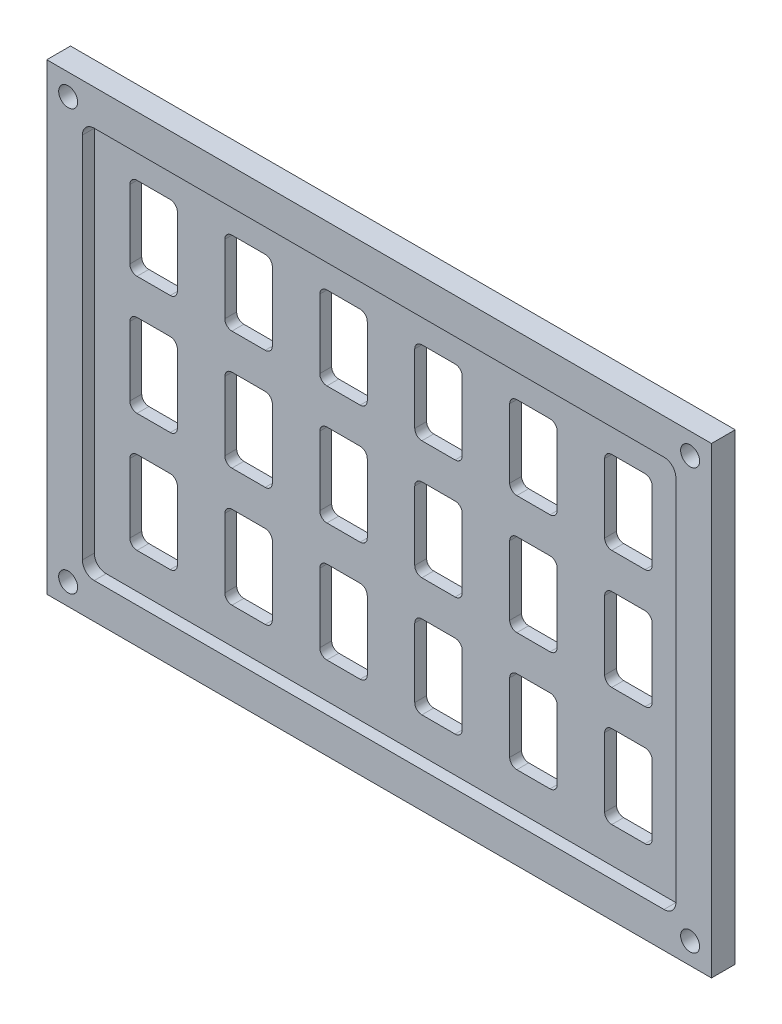
from build123d import *

# Parameters (mm, degrees)
SKETCH1_W           = 280
SKETCH1_H           = 195
BOSS_EXTRUDE1_DEPTH = 5
SKETCH9_W           = 280
SKETCH9_H           = 195
BOSS_EXTRUDE2_DEPTH = 5
SKETCH10_R          = 4
CUT_EXTRUDE1_DEPTH  = 171.898361607


with BuildPart() as part:
    # Sketch1 → Boss-Extrude1 (new body)
    with BuildSketch(Plane.XY):
        Rectangle(SKETCH1_W, SKETCH1_H)
        with BuildLine():
            Line((-70, 64.5), (-70, 35.5))
            ThreePointArc((-70, 35.5), (-69.121320344, 33.378679656), (-67, 32.5))
            Line((-67, 32.5), (-53, 32.5))
            ThreePointArc((-53, 32.5), (-50.878679656, 33.378679656), (-50, 35.5))
            Line((-50, 35.5), (-50, 64.5))
            ThreePointArc((-50, 64.5), (-50.878679656, 66.621320344), (-53, 67.5))
            Line((-53, 67.5), (-67, 67.5))
            ThreePointArc((-67, 67.5), (-69.121320344, 66.621320344), (-70, 64.5))
        make_face(mode=Mode.SUBTRACT)
        with BuildLine():
            Line((-107, 67.5), (-93, 67.5))
            ThreePointArc((-93, 67.5), (-90.878679656, 66.621320344), (-90, 64.5))
            Line((-90, 64.5), (-90, 35.5))
            ThreePointArc((-90, 35.5), (-90.878679656, 33.378679656), (-93, 32.5))
            Line((-93, 32.5), (-107, 32.5))
            ThreePointArc((-107, 32.5), (-109.121320344, 33.378679656), (-110, 35.5))
            Line((-110, 35.5), (-110, 64.5))
            ThreePointArc((-110, 64.5), (-109.121320344, 66.621320344), (-107, 67.5))
        make_face(mode=Mode.SUBTRACT)
        with BuildLine():
            Line((-30, 64.5), (-30, 35.5))
            ThreePointArc((-30, 35.5), (-29.121320344, 33.378679656), (-27, 32.5))
            Line((-27, 32.5), (-13, 32.5))
            ThreePointArc((-13, 32.5), (-10.878679656, 33.378679656), (-10, 35.5))
            Line((-10, 35.5), (-10, 64.5))
            ThreePointArc((-10, 64.5), (-10.878679656, 66.621320344), (-13, 67.5))
            Line((-13, 67.5), (-27, 67.5))
            ThreePointArc((-27, 67.5), (-29.121320344, 66.621320344), (-30, 64.5))
        make_face(mode=Mode.SUBTRACT)
        with BuildLine():
            Line((10, 64.5), (10, 35.5))
            ThreePointArc((10, 35.5), (10.878679656, 33.378679656), (13, 32.5))
            Line((13, 32.5), (27, 32.5))
            ThreePointArc((27, 32.5), (29.121320344, 33.378679656), (30, 35.5))
            Line((30, 35.5), (30, 64.5))
            ThreePointArc((30, 64.5), (29.121320344, 66.621320344), (27, 67.5))
            Line((27, 67.5), (13, 67.5))
            ThreePointArc((13, 67.5), (10.878679656, 66.621320344), (10, 64.5))
        make_face(mode=Mode.SUBTRACT)
        with BuildLine():
            Line((50, 64.5), (50, 35.5))
            ThreePointArc((50, 35.5), (50.878679656, 33.378679656), (53, 32.5))
            Line((53, 32.5), (67, 32.5))
            ThreePointArc((67, 32.5), (69.121320344, 33.378679656), (70, 35.5))
            Line((70, 35.5), (70, 64.5))
            ThreePointArc((70, 64.5), (69.121320344, 66.621320344), (67, 67.5))
            Line((67, 67.5), (53, 67.5))
            ThreePointArc((53, 67.5), (50.878679656, 66.621320344), (50, 64.5))
        make_face(mode=Mode.SUBTRACT)
        with BuildLine():
            Line((90, 64.5), (90, 35.5))
            ThreePointArc((90, 35.5), (90.878679656, 33.378679656), (93, 32.5))
            Line((93, 32.5), (107, 32.5))
            ThreePointArc((107, 32.5), (109.121320344, 33.378679656), (110, 35.5))
            Line((110, 35.5), (110, 64.5))
            ThreePointArc((110, 64.5), (109.121320344, 66.621320344), (107, 67.5))
            Line((107, 67.5), (93, 67.5))
            ThreePointArc((93, 67.5), (90.878679656, 66.621320344), (90, 64.5))
        make_face(mode=Mode.SUBTRACT)
        with BuildLine():
            Line((-70, 14.5), (-70, -14.5))
            ThreePointArc((-70, -14.5), (-69.121320344, -16.621320344), (-67, -17.5))
            Line((-67, -17.5), (-53, -17.5))
            ThreePointArc((-53, -17.5), (-50.878679656, -16.621320344), (-50, -14.5))
            Line((-50, -14.5), (-50, 14.5))
            ThreePointArc((-50, 14.5), (-50.878679656, 16.621320344), (-53, 17.5))
            Line((-53, 17.5), (-67, 17.5))
            ThreePointArc((-67, 17.5), (-69.121320344, 16.621320344), (-70, 14.5))
        make_face(mode=Mode.SUBTRACT)
        with BuildLine():
            Line((-30, 14.5), (-30, -14.5))
            ThreePointArc((-30, -14.5), (-29.121320344, -16.621320344), (-27, -17.5))
            Line((-27, -17.5), (-13, -17.5))
            ThreePointArc((-13, -17.5), (-10.878679656, -16.621320344), (-10, -14.5))
            Line((-10, -14.5), (-10, 14.5))
            ThreePointArc((-10, 14.5), (-10.878679656, 16.621320344), (-13, 17.5))
            Line((-13, 17.5), (-27, 17.5))
            ThreePointArc((-27, 17.5), (-29.121320344, 16.621320344), (-30, 14.5))
        make_face(mode=Mode.SUBTRACT)
        with BuildLine():
            Line((10, 14.5), (10, -14.5))
            ThreePointArc((10, -14.5), (10.878679656, -16.621320344), (13, -17.5))
            Line((13, -17.5), (27, -17.5))
            ThreePointArc((27, -17.5), (29.121320344, -16.621320344), (30, -14.5))
            Line((30, -14.5), (30, 14.5))
            ThreePointArc((30, 14.5), (29.121320344, 16.621320344), (27, 17.5))
            Line((27, 17.5), (13, 17.5))
            ThreePointArc((13, 17.5), (10.878679656, 16.621320344), (10, 14.5))
        make_face(mode=Mode.SUBTRACT)
        with BuildLine():
            Line((50, 14.5), (50, -14.5))
            ThreePointArc((50, -14.5), (50.878679656, -16.621320344), (53, -17.5))
            Line((53, -17.5), (67, -17.5))
            ThreePointArc((67, -17.5), (69.121320344, -16.621320344), (70, -14.5))
            Line((70, -14.5), (70, 14.5))
            ThreePointArc((70, 14.5), (69.121320344, 16.621320344), (67, 17.5))
            Line((67, 17.5), (53, 17.5))
            ThreePointArc((53, 17.5), (50.878679656, 16.621320344), (50, 14.5))
        make_face(mode=Mode.SUBTRACT)
        with BuildLine():
            Line((90, 14.5), (90, -14.5))
            ThreePointArc((90, -14.5), (90.878679656, -16.621320344), (93, -17.5))
            Line((93, -17.5), (107, -17.5))
            ThreePointArc((107, -17.5), (109.121320344, -16.621320344), (110, -14.5))
            Line((110, -14.5), (110, 14.5))
            ThreePointArc((110, 14.5), (109.121320344, 16.621320344), (107, 17.5))
            Line((107, 17.5), (93, 17.5))
            ThreePointArc((93, 17.5), (90.878679656, 16.621320344), (90, 14.5))
        make_face(mode=Mode.SUBTRACT)
        with BuildLine():
            Line((-70, -35.5), (-70, -64.5))
            ThreePointArc((-70, -64.5), (-69.121320344, -66.621320344), (-67, -67.5))
            Line((-67, -67.5), (-53, -67.5))
            ThreePointArc((-53, -67.5), (-50.878679656, -66.621320344), (-50, -64.5))
            Line((-50, -64.5), (-50, -35.5))
            ThreePointArc((-50, -35.5), (-50.878679656, -33.378679656), (-53, -32.5))
            Line((-53, -32.5), (-67, -32.5))
            ThreePointArc((-67, -32.5), (-69.121320344, -33.378679656), (-70, -35.5))
        make_face(mode=Mode.SUBTRACT)
        with BuildLine():
            Line((-30, -35.5), (-30, -64.5))
            ThreePointArc((-30, -64.5), (-29.121320344, -66.621320344), (-27, -67.5))
            Line((-27, -67.5), (-13, -67.5))
            ThreePointArc((-13, -67.5), (-10.878679656, -66.621320344), (-10, -64.5))
            Line((-10, -64.5), (-10, -35.5))
            ThreePointArc((-10, -35.5), (-10.878679656, -33.378679656), (-13, -32.5))
            Line((-13, -32.5), (-27, -32.5))
            ThreePointArc((-27, -32.5), (-29.121320344, -33.378679656), (-30, -35.5))
        make_face(mode=Mode.SUBTRACT)
        with BuildLine():
            Line((10, -35.5), (10, -64.5))
            ThreePointArc((10, -64.5), (10.878679656, -66.621320344), (13, -67.5))
            Line((13, -67.5), (27, -67.5))
            ThreePointArc((27, -67.5), (29.121320344, -66.621320344), (30, -64.5))
            Line((30, -64.5), (30, -35.5))
            ThreePointArc((30, -35.5), (29.121320344, -33.378679656), (27, -32.5))
            Line((27, -32.5), (13, -32.5))
            ThreePointArc((13, -32.5), (10.878679656, -33.378679656), (10, -35.5))
        make_face(mode=Mode.SUBTRACT)
        with BuildLine():
            Line((50, -35.5), (50, -64.5))
            ThreePointArc((50, -64.5), (50.878679656, -66.621320344), (53, -67.5))
            Line((53, -67.5), (67, -67.5))
            ThreePointArc((67, -67.5), (69.121320344, -66.621320344), (70, -64.5))
            Line((70, -64.5), (70, -35.5))
            ThreePointArc((70, -35.5), (69.121320344, -33.378679656), (67, -32.5))
            Line((67, -32.5), (53, -32.5))
            ThreePointArc((53, -32.5), (50.878679656, -33.378679656), (50, -35.5))
        make_face(mode=Mode.SUBTRACT)
        with BuildLine():
            Line((90, -35.5), (90, -64.5))
            ThreePointArc((90, -64.5), (90.878679656, -66.621320344), (93, -67.5))
            Line((93, -67.5), (107, -67.5))
            ThreePointArc((107, -67.5), (109.121320344, -66.621320344), (110, -64.5))
            Line((110, -64.5), (110, -35.5))
            ThreePointArc((110, -35.5), (109.121320344, -33.378679656), (107, -32.5))
            Line((107, -32.5), (93, -32.5))
            ThreePointArc((93, -32.5), (90.878679656, -33.378679656), (90, -35.5))
        make_face(mode=Mode.SUBTRACT)
        with BuildLine():
            Line((-110, 14.5), (-110, -14.5))
            ThreePointArc((-110, -14.5), (-109.121320344, -16.621320344), (-107, -17.5))
            Line((-107, -17.5), (-93, -17.5))
            ThreePointArc((-93, -17.5), (-90.878679656, -16.621320344), (-90, -14.5))
            Line((-90, -14.5), (-90, 14.5))
            ThreePointArc((-90, 14.5), (-90.878679656, 16.621320344), (-93, 17.5))
            Line((-93, 17.5), (-107, 17.5))
            ThreePointArc((-107, 17.5), (-109.121320344, 16.621320344), (-110, 14.5))
        make_face(mode=Mode.SUBTRACT)
        with BuildLine():
            Line((-110, -35.5), (-110, -64.5))
            ThreePointArc((-110, -64.5), (-109.121320344, -66.621320344), (-107, -67.5))
            Line((-107, -67.5), (-93, -67.5))
            ThreePointArc((-93, -67.5), (-90.878679656, -66.621320344), (-90, -64.5))
            Line((-90, -64.5), (-90, -35.5))
            ThreePointArc((-90, -35.5), (-90.878679656, -33.378679656), (-93, -32.5))
            Line((-93, -32.5), (-107, -32.5))
            ThreePointArc((-107, -32.5), (-109.121320344, -33.378679656), (-110, -35.5))
        make_face(mode=Mode.SUBTRACT)
    extrude(amount=BOSS_EXTRUDE1_DEPTH)

    # Sketch9 → Boss-Extrude2 (add)
    with BuildSketch(Plane.XY.offset(5)):
        Rectangle(SKETCH9_W, SKETCH9_H)
        with BuildLine():
            Line((-125, 77.5), (-125, -77.5))
            ThreePointArc((-125, -77.5), (-123.535533906, -81.035533906), (-120, -82.5))
            Line((-120, -82.5), (120, -82.5))
            ThreePointArc((120, -82.5), (123.535533906, -81.035533906), (125, -77.5))
            Line((125, -77.5), (125, 77.5))
            ThreePointArc((125, 77.5), (123.535533906, 81.035533906), (120, 82.5))
            Line((120, 82.5), (-120, 82.5))
            ThreePointArc((-120, 82.5), (-123.535533906, 81.035533906), (-125, 77.5))
        make_face(mode=Mode.SUBTRACT)
    extrude(amount=BOSS_EXTRUDE2_DEPTH)

    # Sketch10 → Cut-Extrude1 (cut, through all)
    with BuildSketch(Plane.XY.offset(10)):
        with Locations((-131, 88.5)):
            Circle(SKETCH10_R)
        with Locations(Location((131, 88.5, 0), (0, 0, 180))):
            Circle(SKETCH10_R)
        with Locations((131, -88.5)):
            Circle(SKETCH10_R)
        with Locations(Location((-131, -88.5, 0), (0, 0, 180))):
            Circle(SKETCH10_R)
    extrude(amount=-CUT_EXTRUDE1_DEPTH, mode=Mode.SUBTRACT)


solid = part.part
